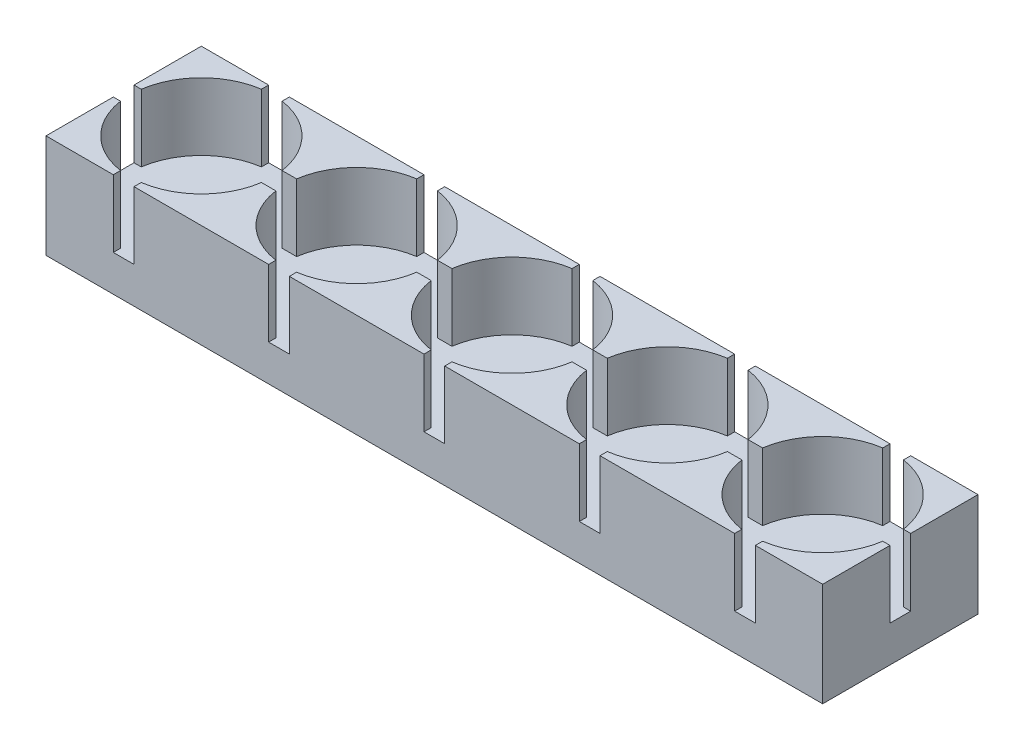
from build123d import *

# Parameters (mm, degrees)
SKETCH2_W                                           = 150
SKETCH2_H                                           = 30
BOSS_EXTRUDE1_DEPTH                                 = 20
SKETCH3_R                                           = 13.75
CUT_EXTRUDE1_DEPTH                                  = 13
LPATTERN1_COUNT                                     = 5
LPATTERN1_PITCH                                     = 30
CBORE_FOR_M4_HEX_SOCKET_HEAD_CAP_SCREW1_D           = 4.5
CBORE_FOR_M4_HEX_SOCKET_HEAD_CAP_SCREW1_CBORE_D     = 8
CBORE_FOR_M4_HEX_SOCKET_HEAD_CAP_SCREW1_CBORE_DEPTH = 4.4
LPATTERN2_COUNT                                     = 2
LPATTERN2_PITCH                                     = 120
SKETCH7_W                                           = 181.12901383
SKETCH7_H                                           = 4
CUT_EXTRUDE3_DEPTH                                  = 13
SKETCH8_W                                           = 4
SKETCH8_H                                           = 50
CUT_EXTRUDE4_DEPTH                                  = 13
LPATTERN3_COUNT                                     = 5
LPATTERN3_PITCH                                     = 30


with BuildPart() as part:
    # Sketch2 → Boss-Extrude1 (new body)
    with BuildSketch(Plane(origin=(0, 0, 0), x_dir=(1, 0, 0), z_dir=(0, 1, 0))):
        Rectangle(SKETCH2_W, SKETCH2_H)
    extrude(amount=BOSS_EXTRUDE1_DEPTH)

    # Sketch3 → Cut-Extrude1 (cut)
    with BuildSketch(Plane(origin=(0, 20, 0), x_dir=(1, 0, 0), z_dir=(0, 1, 0))):
        with Locations(Location((-60, 0, 0), (0, 0, 270))):
            Circle(SKETCH3_R)
    cut_extrude1 = extrude(amount=-CUT_EXTRUDE1_DEPTH, mode=Mode.SUBTRACT)

    # LPattern1: Cut-Extrude1 ×5
    with Locations(*[(i * LPATTERN1_PITCH, 0, 0) for i in range(1, LPATTERN1_COUNT)]):
        add(cut_extrude1, mode=Mode.SUBTRACT)

    # CBORE for M4 Hex Socket Head Cap Screw1 (through all)
    with Locations(Plane(origin=(0, 7, 0), x_dir=(-1, 0, 0), z_dir=(0, 1, 0))):
        with Locations((60, 0)):
            cbore_for_m4_hex_socket_head_cap_screw1 = CounterBoreHole(CBORE_FOR_M4_HEX_SOCKET_HEAD_CAP_SCREW1_D / 2, CBORE_FOR_M4_HEX_SOCKET_HEAD_CAP_SCREW1_CBORE_D / 2, CBORE_FOR_M4_HEX_SOCKET_HEAD_CAP_SCREW1_CBORE_DEPTH)

    # LPattern2: CBORE for M4 Hex Socket Head Cap Screw1 ×2
    with Locations(*[(i * LPATTERN2_PITCH, 0, 0) for i in range(1, LPATTERN2_COUNT)]):
        add(cbore_for_m4_hex_socket_head_cap_screw1, mode=Mode.SUBTRACT)

    # Sketch7 → Cut-Extrude3 (cut)
    with BuildSketch(Plane(origin=(0, 20, 0), x_dir=(1, 0, 0), z_dir=(0, 1, 0))):
        Rectangle(SKETCH7_W, SKETCH7_H)
    extrude(amount=-CUT_EXTRUDE3_DEPTH, mode=Mode.SUBTRACT)

    # Sketch8 → Cut-Extrude4 (cut)
    with BuildSketch(Plane(origin=(0, 20, 0), x_dir=(-1, 0, 0), z_dir=(0, 1, 0))):
        with Locations((60, -1.298701607)):
            Rectangle(SKETCH8_W, SKETCH8_H)
    cut_extrude4 = extrude(amount=-CUT_EXTRUDE4_DEPTH, mode=Mode.SUBTRACT)

    # LPattern3: Cut-Extrude4 ×5
    with Locations(*[(i * LPATTERN3_PITCH, 0, 0) for i in range(1, LPATTERN3_COUNT)]):
        add(cut_extrude4, mode=Mode.SUBTRACT)


solid = part.part
